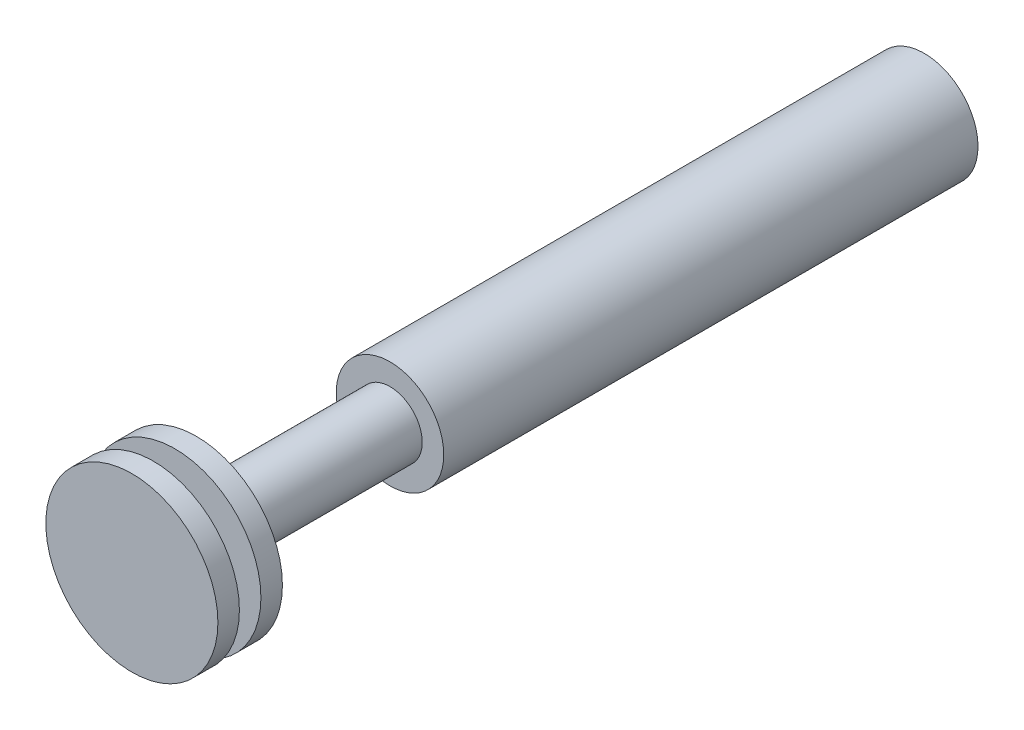
from build123d import *

# Parameters (mm, degrees)
SKETCH_1_R               = 3
EXTRUDE_1_DEPTH          = 180
SKETCH_2_R               = 8
EXTRUDE_2_DEPTH          = 2
EXTRUDE_START            = -178
SKETCH_2_2_R             = 8
EXTRUDE_3_DEPTH          = 2
EXTRUDE_START_2          = -2
SKETCH_1_2_R             = 3
EXTRUDE_4_DEPTH          = 2
EXTRUDE_START_3          = 180
SKETCH_1_3_R             = 3
EXTRUDE_5_DEPTH          = 2
EXTRUDE_START_4          = 4
SKETCH_2_3_R             = 8
EXTRUDE_6_DEPTH          = 2
EXTRUDE_START_5          = -182
SKETCH_2_4_R             = 8
EXTRUDE_7_DEPTH          = 2
EXTRUDE_START_6          = -64
SKETCH_3_R               = 5
EXTRUDE_10_DEPTH         = 60
CUT_EXTRUDE_1_DEPTH      = 185.347497949
CUT_EXTRUDE_1_DEPTH_BACK = 185.347497949
SKETCH_4_W               = 129.449632944
SKETCH_4_H               = 45.19740272
EXTRUDE_START_7          = 20
SKETCH_5_R               = 5
EXTRUDE_11_DEPTH         = 20
EXTRUDE_START_8          = 40
SKETCH_5_2_R             = 5
EXTRUDE_12_DEPTH         = 40


with BuildPart() as part:
    # 草图1 → 凸台-拉伸1 (new body)
    with BuildSketch(Plane.XY):
        with Locations(Location((0, 0, 0), (0, 0, 180))):
            Circle(SKETCH_1_R)
    extrude(amount=EXTRUDE_1_DEPTH)

    # 草图2 → 凸台-拉伸2 (add)
    with BuildSketch(Plane.XY.offset(180)):
        Circle(SKETCH_2_R)
    extrude(amount=-EXTRUDE_2_DEPTH)

    # 草图2<2> → 凸台-拉伸3 (add)
    with BuildSketch(Plane.XY.offset(180).offset(EXTRUDE_START)):
        Circle(SKETCH_2_2_R)
    extrude(amount=-EXTRUDE_3_DEPTH)

    # 草图1<2> → 凸台-拉伸4 (add)
    with BuildSketch(Plane.XY.offset(EXTRUDE_START_2)):
        with Locations(Location((0, 0, 0), (0, 0, 180))):
            Circle(SKETCH_1_2_R)
    extrude(amount=EXTRUDE_4_DEPTH)

    # 草图1<3> → 凸台-拉伸5 (add)
    with BuildSketch(Plane.XY.offset(EXTRUDE_START_3)):
        with Locations(Location((0, 0, 0), (0, 0, 180))):
            Circle(SKETCH_1_3_R)
    extrude(amount=EXTRUDE_5_DEPTH)

    # 草图2<3> → 凸台-拉伸6 (add)
    with BuildSketch(Plane.XY.offset(180).offset(EXTRUDE_START_4)):
        Circle(SKETCH_2_3_R)
    extrude(amount=-EXTRUDE_6_DEPTH)

    # 草图2<4> → 凸台-拉伸7 (add)
    with BuildSketch(Plane.XY.offset(180).offset(EXTRUDE_START_5)):
        Circle(SKETCH_2_4_R)
    extrude(amount=-EXTRUDE_7_DEPTH)

    # 草图3 → 凸台-拉伸10 (add)
    with BuildSketch(Plane.XY.offset(184).offset(EXTRUDE_START_6)):
        Circle(SKETCH_3_R)
    extrude(amount=-EXTRUDE_10_DEPTH)

    # 草图4 → 切除-拉伸1 (cut, two sides: drawn at the far end of the back side and taken through both)
    with BuildSketch(Plane(origin=(0, 0, 0), x_dir=(0, 0, -1), z_dir=(1, 0, 0)).offset(-CUT_EXTRUDE_1_DEPTH_BACK)):
        with Locations((-45.596015123, 0.262013929)):
            Rectangle(SKETCH_4_W, SKETCH_4_H)
    extrude(amount=CUT_EXTRUDE_1_DEPTH + CUT_EXTRUDE_1_DEPTH_BACK, mode=Mode.SUBTRACT)

    # 草图5 → 凸台-拉伸11 (add)
    with BuildSketch(Plane.XY.offset(120).offset(EXTRUDE_START_7)):
        Circle(SKETCH_5_R)
    extrude(amount=-EXTRUDE_11_DEPTH)

    # 草图5<2> → 凸台-拉伸12 (add)
    with BuildSketch(Plane.XY.offset(120).offset(EXTRUDE_START_8)):
        Circle(SKETCH_5_2_R)
    extrude(amount=-EXTRUDE_12_DEPTH)


solid = part.part
